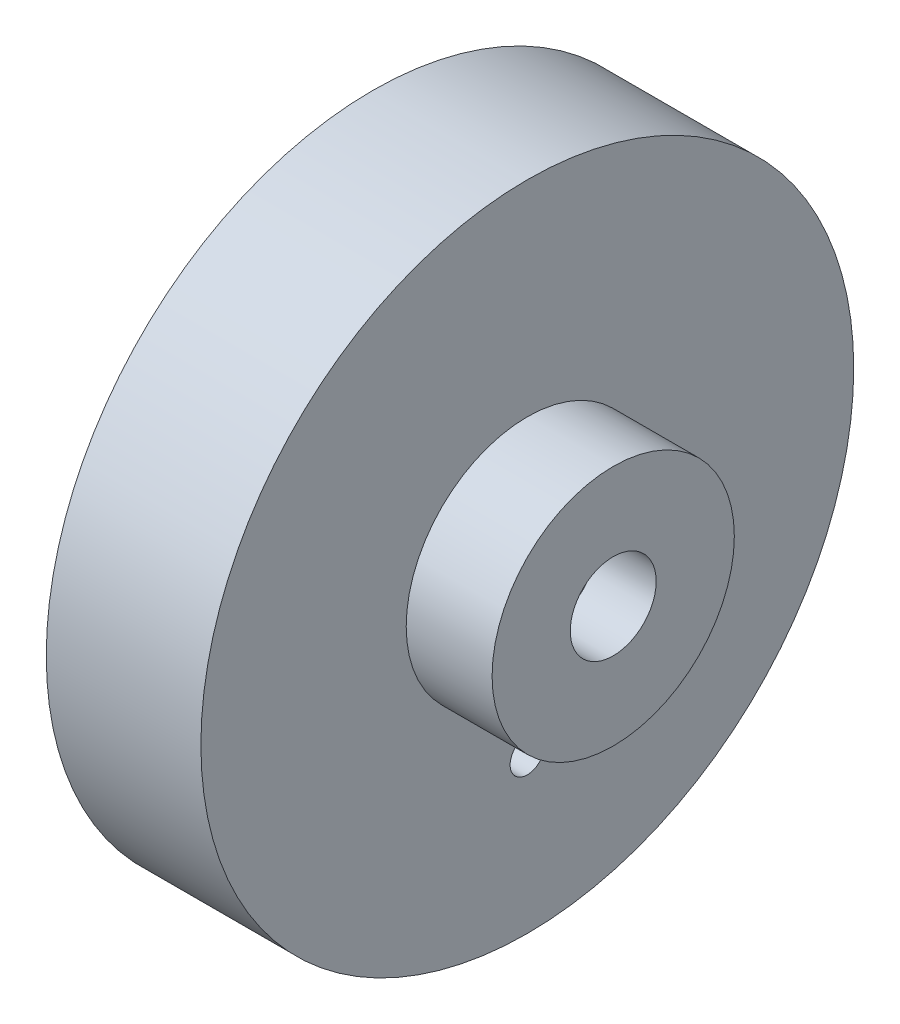
from build123d import *
from build123d.topology import SkipClean

# Parameters (mm, degrees)
BASPROSKE_W             = 5
BASPROSKE_H             = 3.5
TOOTHCUT_DEPTH          = 28.331300737
TEETHCUTS_COUNT         = 33
TEETHCUTS_ANGLE         = 349.090909091
ESQUISSE1_R             = 19
ESQUISSE1_R_2           = 17.751
BOSS_EXTRU_1_DEPTH      = 1
ESQUISSE2_R             = 19
ESQUISSE2_R_2           = 5.05
BOSS_EXTRU_2_DEPTH      = 3
ESQUISSE3_R             = 1
ENL_V_MAT_EXTRU_1_DEPTH = 28.531799796
ESQUISSE4_R             = 2
ENL_V_MAT_EXTRU_2_DEPTH = 1.5
ESQUISSE5_R             = 7.05
ESQUISSE5_R_2           = 5.05
BOSS_EXTRU_3_DEPTH      = 5
ESQUISSE6_R             = 7
ESQUISSE6_R_2           = 2.5
BOSS_EXTRU_4_DEPTH      = 3.5
CHANFREIN1_SIZE         = 0.5


with BuildPart() as part:
    # BasProSke → Base-Revolve (revolve)
    with BuildSketch(Plane(origin=(0, 0, 0), x_dir=(1, 0, 0), z_dir=(0, 1, 0)), mode=Mode.PRIVATE) as base_revolve_sk:
        with Locations((2.5, 17.25)):
            Rectangle(BASPROSKE_W, BASPROSKE_H)
    revolve(base_revolve_sk.sketch.rotate(Axis((-10, 0, 0), (1, 0, 0)), 180), axis=Axis((-10, 0, 0), (1, 0, 0)))

    # TooCutSke → ToothCut (cut, through all)
    with BuildSketch(Plane(origin=(0, 0, 0), x_dir=(0, 0, -1), z_dir=(1, 0, 0))):
        with BuildLine():
            ThreePointArc((1.226742235, 15.425898633), (0.817607038, 16.626147417), (0.22936635, 17.74951808))
            ThreePointArc((0.22936635, 17.74951808), (0, 17.751), (-0.22936635, 17.74951808))
            ThreePointArc((-0.22936635, 17.74951808), (-0.817607038, 16.626147417), (-1.226742235, 15.425898633))
            ThreePointArc((-1.226742235, 15.425898633), (0, 15.4746), (1.226742235, 15.425898633))
        make_face()
    toothcut = extrude(amount=TOOTHCUT_DEPTH, mode=Mode.SUBTRACT)

    # TeethCuts: ToothCut ×33 about axis
    teethcuts_axis = Axis((-10, 0, 0), (1, 0, 0))
    for i in range(1, TEETHCUTS_COUNT):
        add(toothcut.rotate(teethcuts_axis, i * TEETHCUTS_ANGLE / (TEETHCUTS_COUNT - 1)), mode=Mode.SUBTRACT)

    # Esquisse1 → Boss.-Extru.1 (add)
    with SkipClean():  # the faces are left unmerged after this step: merging them gives an invalid solid
        with BuildSketch(Plane(origin=(5, 0, 0), x_dir=(0, 0, -1), z_dir=(1, 0, 0))):
            with Locations(Location((0, 0, 0), (0, 0, 180))):
                Circle(ESQUISSE1_R)
            with Locations(Location((0, 0, 0), (0, 0, 178.013084972))):
                Circle(ESQUISSE1_R_2, mode=Mode.SUBTRACT)
        extrude(amount=BOSS_EXTRU_1_DEPTH)

    # Esquisse2 → Boss.-Extru.2 (add)
    with SkipClean():  # the faces are left unmerged after this step: merging them gives an invalid solid
        with BuildSketch(Plane(origin=(6, 0, 0), x_dir=(0, 0, -1), z_dir=(1, 0, 0))):
            with Locations(Location((0, 0, 0), (0, 0, 180))):
                Circle(ESQUISSE2_R)
            Circle(ESQUISSE2_R_2, mode=Mode.SUBTRACT)
        extrude(amount=BOSS_EXTRU_2_DEPTH)

    # Esquisse3 → Enlèv. mat.-Extru.1 (cut, through all)
    with SkipClean():  # the faces are left unmerged after this step: merging them gives an invalid solid
        with BuildSketch(Plane.ZY.offset(-6)):
            with Locations((0, -10)):
                Circle(ESQUISSE3_R)
        extrude(amount=-ENL_V_MAT_EXTRU_1_DEPTH, mode=Mode.SUBTRACT)

    # Esquisse4 → Enlèv. mat.-Extru.2 (cut)
    with SkipClean():  # the faces are left unmerged after this step: merging them gives an invalid solid
        with BuildSketch(Plane.ZY.offset(-6)):
            with Locations((0, -10)):
                Circle(ESQUISSE4_R)
        extrude(amount=-ENL_V_MAT_EXTRU_2_DEPTH, mode=Mode.SUBTRACT)

    # Esquisse5 → Boss.-Extru.3 (add)
    with SkipClean():  # the faces are left unmerged after this step: merging them gives an invalid solid
        with BuildSketch(Plane(origin=(9, 0, 0), x_dir=(0, 0, -1), z_dir=(1, 0, 0))):
            Circle(ESQUISSE5_R)
            Circle(ESQUISSE5_R_2, mode=Mode.SUBTRACT)
        extrude(amount=BOSS_EXTRU_3_DEPTH)

    # Esquisse6 → Boss.-Extru.4 (add)
    with SkipClean():  # the faces are left unmerged after this step: merging them gives an invalid solid
        with BuildSketch(Plane(origin=(14, 0, 0), x_dir=(0, 0, -1), z_dir=(1, 0, 0))):
            Circle(ESQUISSE6_R)
            Circle(ESQUISSE6_R_2, mode=Mode.SUBTRACT)
        extrude(amount=-BOSS_EXTRU_4_DEPTH)

    # Chanfrein1
    chanfrein1_edges = [part.edges().sort_by_distance(p)[0] for p in [
        (6, 0, 5.05),
    ]]
    chamfer(chanfrein1_edges, length=CHANFREIN1_SIZE)


solid = part.part
